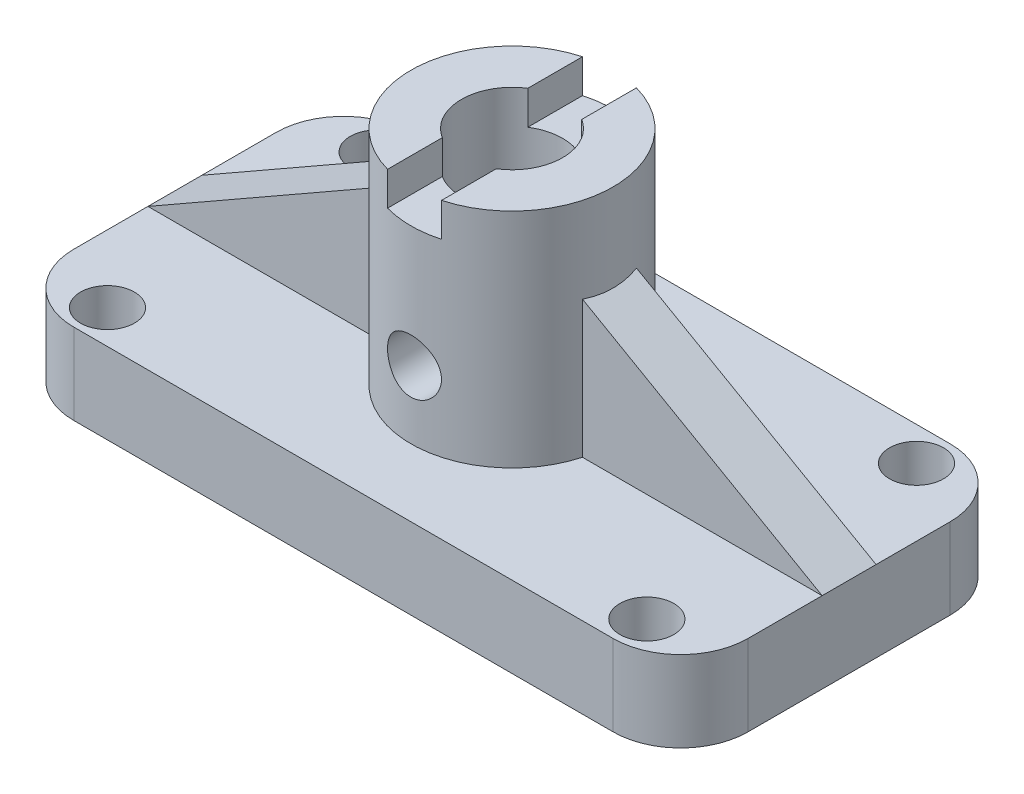
from build123d import *

# Parameters (mm, degrees)
SKETCH_1_W          = 100
SKETCH_1_H          = 50
EXTRUDE_1_DEPTH     = 12
SKETCH_2_R          = 4
CUT_EXTRUDE_1_DEPTH = 58.175169436
SKETCH_3_R          = 15
EXTRUDE_2_DEPTH     = 33
SKETCH_4_R          = 7.5
CUT_EXTRUDE_2_DEPTH = 72.763500472
SKETCH_5_W          = 8
SKETCH_5_H          = 30
CUT_EXTRUDE_3_DEPTH = 5
FILLET_2_R          = 10
FILLET_3_R          = 10
RIB_30_REACH        = 73.764
SKETCH_11_WALL_W    = 185.838289686
SKETCH_11_WALL_H    = 8
RIB_31_REACH        = 73.764
SKETCH_15_WALL_W    = 185.838289686
SKETCH_15_WALL_H    = 8
SKETCH_16_R         = 4
CUT_EXTRUDE_4_DEPTH = 79.262379212


with BuildPart() as part:
    # 草图1 → 凸台-拉伸1 (new body)
    with BuildSketch(Plane(origin=(0, 0, 0), x_dir=(1, 0, 0), z_dir=(0, 1, 0))):
        Rectangle(SKETCH_1_W, SKETCH_1_H)
    extrude(amount=EXTRUDE_1_DEPTH)

    # 草图2 → 切除-拉伸1 (cut, through all)
    with BuildSketch(Plane(origin=(0, 12, 0), x_dir=(1, 0, 0), z_dir=(0, 1, 0))):
        with Locations((-40, -20)):
            Circle(SKETCH_2_R)
        with Locations((-40, 20)):
            Circle(SKETCH_2_R)
        with Locations((40, -20)):
            Circle(SKETCH_2_R)
        with Locations((40, 20)):
            Circle(SKETCH_2_R)
    extrude(amount=-CUT_EXTRUDE_1_DEPTH, mode=Mode.SUBTRACT)

    # 草图3 → 凸台-拉伸2 (add)
    with BuildSketch(Plane(origin=(0, 12, 0), x_dir=(1, 0, 0), z_dir=(0, 1, 0))):
        Circle(SKETCH_3_R)
    extrude(amount=EXTRUDE_2_DEPTH)

    # 草图4 → 切除-拉伸2 (cut, through all)
    with BuildSketch(Plane(origin=(0, 45, 0), x_dir=(1, 0, 0), z_dir=(0, 1, 0))):
        Circle(SKETCH_4_R)
    extrude(amount=-CUT_EXTRUDE_2_DEPTH, mode=Mode.SUBTRACT)

    # 草图5 → 切除-拉伸3 (cut)
    with BuildSketch(Plane(origin=(0, 45, 0), x_dir=(1, 0, 0), z_dir=(0, 1, 0))):
        Rectangle(SKETCH_5_W, SKETCH_5_H)
    extrude(amount=-CUT_EXTRUDE_3_DEPTH, mode=Mode.SUBTRACT)

    # 圆角2
    fillet_2_edges = [part.edges().sort_by_distance(p)[0] for p in [
        (-50, 6, -25),
        (-50, 6, 25),
    ]]
    fillet(fillet_2_edges, radius=FILLET_2_R)

    # 圆角3
    fillet_3_edges = [part.edges().sort_by_distance(p)[0] for p in [
        (50, 6, 25),
        (50, 6, -25),
    ]]
    fillet(fillet_3_edges, radius=FILLET_3_R)

    # 草图11 wall → 筋30 (add, up to next)
    with BuildSketch(Plane(origin=(-32.5, 22, 0), x_dir=(0.868243142124, 0.496138938357, 0), z_dir=(-0.496138938357, 0.868243142124, 0)), mode=Mode.PRIVATE) as rib_30_sk1:
        Rectangle(SKETCH_11_WALL_W, SKETCH_11_WALL_H)
    rib_30_tool1 = extrude(rib_30_sk1.sketch, amount=-RIB_30_REACH, mode=Mode.PRIVATE) - part.part
    add(rib_30_tool1.solids().sort_by_distance((-32.5, 22, 0))[0])

    # 草图15 wall → 筋31 (add, up to next)
    with BuildSketch(Plane(origin=(32.5, 22, 0), x_dir=(-0.868243142124, 0.496138938357, 0), z_dir=(-0.496138938357, -0.868243142124, 0)), mode=Mode.PRIVATE) as rib_31_sk1:
        Rectangle(SKETCH_15_WALL_W, SKETCH_15_WALL_H)
    rib_31_tool1 = extrude(rib_31_sk1.sketch, amount=RIB_31_REACH, mode=Mode.PRIVATE) - part.part
    add(rib_31_tool1.solids().sort_by_distance((32.5, 22, 0))[0])

    # 草图16 → 切除-拉伸4 (cut, through all)
    with BuildSketch(Plane.XY.offset(15)):
        with Locations((0, 22)):
            Circle(SKETCH_16_R)
    extrude(amount=-CUT_EXTRUDE_4_DEPTH, mode=Mode.SUBTRACT)


solid = part.part
